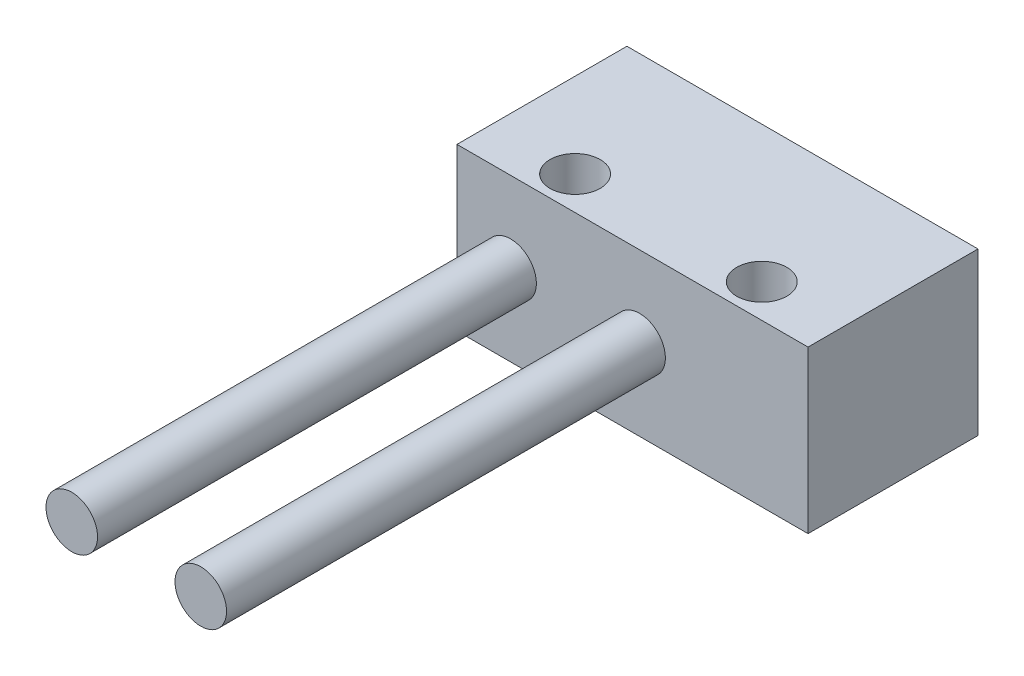
from build123d import *

# Parameters (mm, degrees)
SKETCH1_W           = 12.6
SKETCH1_H           = 6.1
SKETCH1_R           = 0.9
BOSS_EXTRUDE1_DEPTH = 5.8
SKETCH2_W           = 1
SKETCH2_H           = 2.75
BOSS_EXTRUDE2_DEPTH = 1
SKETCH3_R           = 0.925
BOSS_EXTRUDE3_DEPTH = 15.75


with BuildPart() as part:
    # Sketch1 → Boss-Extrude1 (new body)
    with BuildSketch(Plane(origin=(0, 0, 0), x_dir=(1, 0, 0), z_dir=(0, 1, 0))):
        with Locations((6.3, 3.05)):
            Rectangle(SKETCH1_W, SKETCH1_H)
        with Locations(Location((3.04, 1.2, 0), (0, 0, 270))):
            Circle(SKETCH1_R, mode=Mode.SUBTRACT)
        with Locations(Location((9.74, 1.2, 0), (0, 0, 270))):
            Circle(SKETCH1_R, mode=Mode.SUBTRACT)
    extrude(amount=BOSS_EXTRUDE1_DEPTH)

    # Sketch2 → Boss-Extrude2 (add)
    with BuildSketch(Plane(origin=(0, 0, -6.1), x_dir=(-1, 0, 0), z_dir=(0, 0, -1))):
        with Locations((-4.5, 2.9)):
            Rectangle(SKETCH2_W, SKETCH2_H)
    extrude(amount=BOSS_EXTRUDE2_DEPTH)

    # Sketch3 → Boss-Extrude3 (add)
    with BuildSketch(Plane.XY):
        with Locations(Location((1.925, 2.9, 0), (0, 0, 180))):
            Circle(SKETCH3_R)
        with Locations(Location((6.555, 2.9, 0), (0, 0, 180))):
            Circle(SKETCH3_R)
    extrude(amount=BOSS_EXTRUDE3_DEPTH)


solid = part.part
